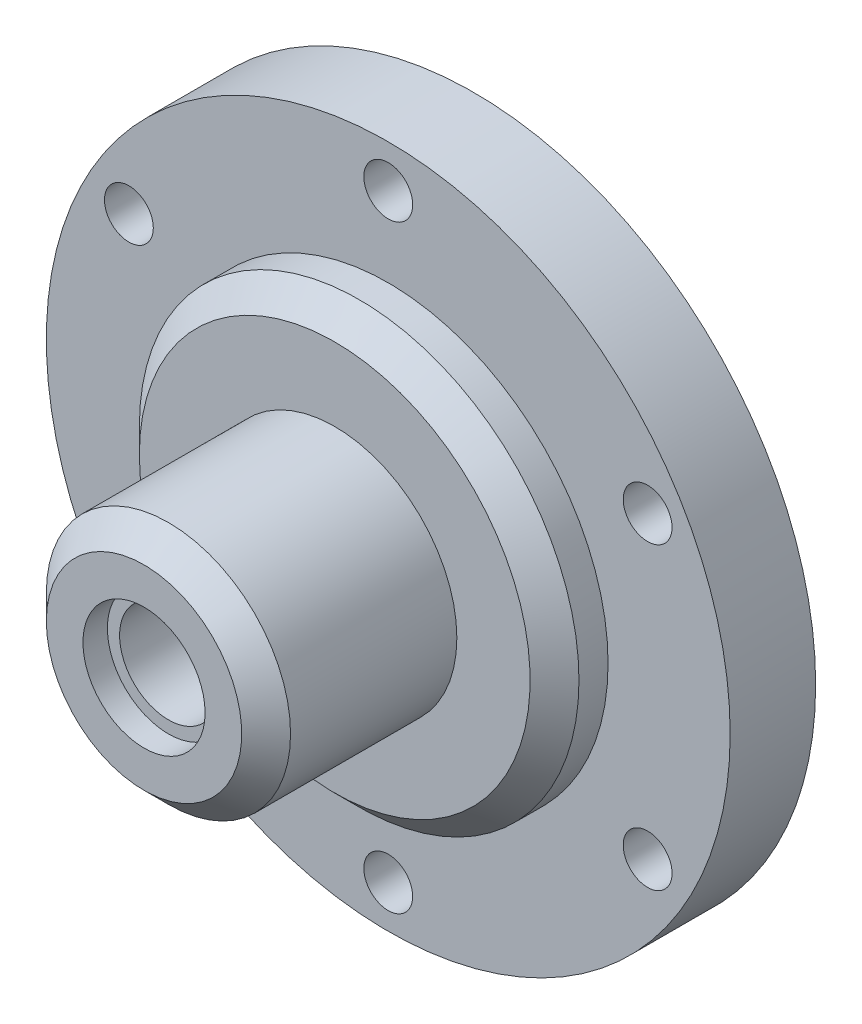
from build123d import *

# Parameters (mm, degrees)
SKETCH1_R                     = 44
TOWER_SHAFT_DEPTH             = 20
SKETCH2_R                     = 33.091378557
MAIN_HOLE_FOR_PROPSHAFT_DEPTH = 4500
BASE_ATTACHMENT_CHAMFER_SIZE  = 10
SKETCH5_R                     = 140
SKETCH5_R_2                   = 70
BASE_FLANGE_DEPTH             = 35
SKETCH7_R                     = 10
BASE_FLANGE_HOLES_M20_DEPTH   = 35
SKETCH8_W                     = 20
SKETCH8_H                     = 7.035786578
CUT_EXTRUDE1_DEPTH            = 35
SCALE1_SCALE                  = 10
SKETCH9_R                     = 250
SKETCH9_R_2                   = 200
CUT_EXTRUDE2_DEPTH            = 100


with BuildPart() as part:
    # Sketch1 → Tower Shaft (new body)
    with BuildSketch(Plane.XY):
        Circle(SKETCH1_R)
    extrude(amount=TOWER_SHAFT_DEPTH)

    # Sketch2 → Main hole for propshaft (cut)
    with BuildSketch(Plane.XY):
        Circle(SKETCH2_R)
    extrude(amount=MAIN_HOLE_FOR_PROPSHAFT_DEPTH, mode=Mode.SUBTRACT)

    # Sketch3 → Base Attachment Main body (revolve)
    with BuildSketch(Plane(origin=(0, 0, 0), x_dir=(0, 0, -1), z_dir=(1, 0, 0)), mode=Mode.PRIVATE) as base_attachment_main_body_sk:
        Polygon((-21.911955585, 50), (-21.911955585, 90), (0, 90), (0, 50), (0, 20), (-100, 20), (-100, 50), align=None)
    revolve(base_attachment_main_body_sk.sketch.rotate(Axis((0, 0, 4855.714784932), (0, 0, -1)), 90), axis=Axis((0, 0, 4855.714784932), (0, 0, -1)))

    # Base attachment chamfer
    base_attachment_chamfer_edges = [part.edges().sort_by_distance(p)[0] for p in [
        (-50, 0, 100),
        (-90, 0, 21.911955585),
    ]]
    chamfer(base_attachment_chamfer_edges, length=BASE_ATTACHMENT_CHAMFER_SIZE)

    # Sketch5 → Base Flange (add)
    with BuildSketch(Plane.XY):
        Circle(SKETCH5_R)
        Circle(SKETCH5_R_2, mode=Mode.SUBTRACT)
    extrude(amount=-BASE_FLANGE_DEPTH)

    # Sketch7 → Base Flange Holes (M20) (cut)
    with BuildSketch(Plane.XY):
        with Locations((0, 122.625)):
            Circle(SKETCH7_R)
        with Locations((106.196365139, 61.3125)):
            Circle(SKETCH7_R)
        with Locations((106.196365139, -61.3125)):
            Circle(SKETCH7_R)
        with Locations((0, -122.625)):
            Circle(SKETCH7_R)
        with Locations((-106.196365139, -61.3125)):
            Circle(SKETCH7_R)
        with Locations((-106.196365139, 61.3125)):
            Circle(SKETCH7_R)
    extrude(amount=-BASE_FLANGE_HOLES_M20_DEPTH, mode=Mode.SUBTRACT)

    # Sketch8 → Cut-Extrude1 (cut)
    with BuildSketch(Plane(origin=(0, 0, -35), x_dir=(-1, 0, 0), z_dir=(0, 0, -1))):
        with Locations((0, 71.482106711)):
            Rectangle(SKETCH8_W, SKETCH8_H)
    extrude(amount=-CUT_EXTRUDE1_DEPTH, mode=Mode.SUBTRACT)


with BuildPart() as part_1:
    # Scale1: scaled about (0, -0.104082902, 3.224050424)
    add(part.part.scale(SCALE1_SCALE).moved(Location((0, 0.936746118, -29.016453816))))

    # Sketch9 → Cut-Extrude2 (cut)
    with BuildSketch(Plane.XY.offset(970.983546187)):
        with Locations((0, 0.936746116)):
            Circle(SKETCH9_R)
        with Locations((0, 0.936746116)):
            Circle(SKETCH9_R_2, mode=Mode.SUBTRACT)
    extrude(amount=-CUT_EXTRUDE2_DEPTH, mode=Mode.SUBTRACT)


solid = part_1.part
